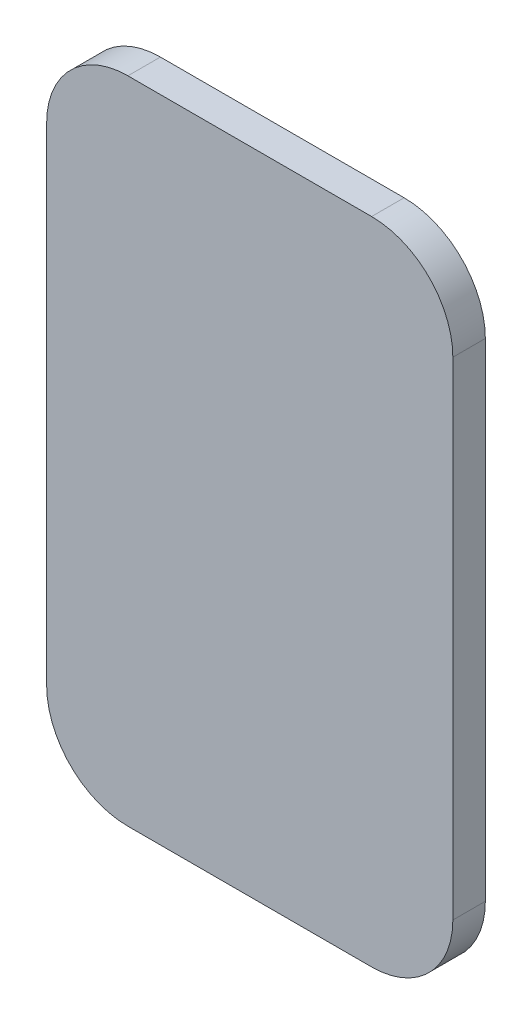
from build123d import *

# Parameters (mm, degrees)
SALIENTE_EXTRUIR1_DEPTH = 2


with BuildPart() as part:
    # Croquis1 → Saliente-Extruir1 (new body)
    with BuildSketch(Plane.XY):
        with BuildLine():
            Line((-21.083176362, 42.831730769), (-6.083176362, 42.831730769))
            ThreePointArc((-6.083176362, 42.831730769), (-2.547642456, 41.367264675), (-1.083176362, 37.831730769))
            Line((-1.083176362, 37.831730769), (-1.083176362, 7.831730769))
            ThreePointArc((-1.083176362, 7.831730769), (-2.547642456, 4.296196863), (-6.083176362, 2.831730769))
            Line((-6.083176362, 2.831730769), (-21.083176362, 2.831730769))
            ThreePointArc((-21.083176362, 2.831730769), (-24.618710268, 4.296196863), (-26.083176362, 7.831730769))
            Line((-26.083176362, 7.831730769), (-26.083176362, 37.831730769))
            ThreePointArc((-26.083176362, 37.831730769), (-24.618710268, 41.367264675), (-21.083176362, 42.831730769))
        make_face()
    extrude(amount=SALIENTE_EXTRUIR1_DEPTH)


solid = part.part
